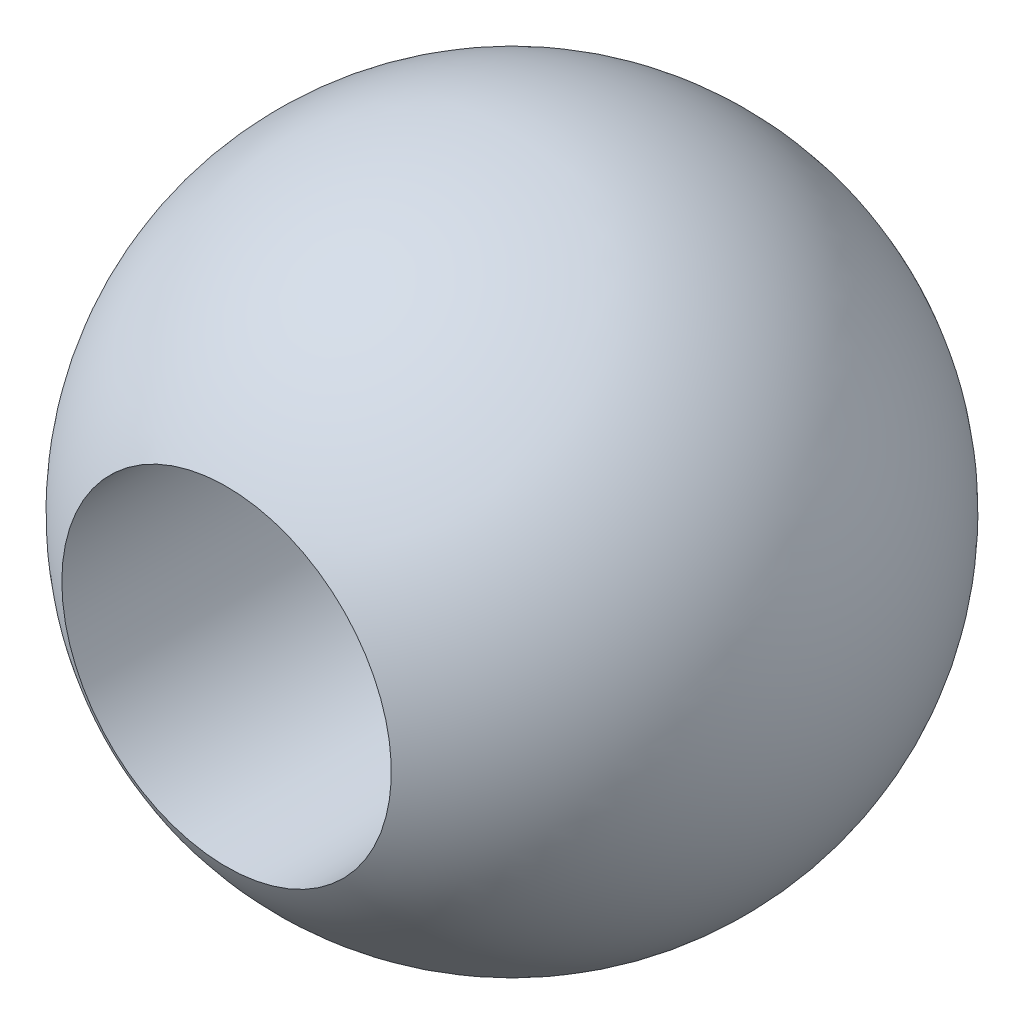
from build123d import *

# Parameters (mm, degrees)
CUT_EXTRUDE_1_DEPTH      = 7.92820323
CUT_EXTRUDE_1_DEPTH_BACK = 7.92820323
SKETCH_2_R               = 2


with BuildPart() as part:
    # 草图1 → 旋转1 (revolve)
    with BuildSketch(Plane.XY):
        with BuildLine():
            Line((0, 4), (0, -4))
            ThreePointArc((0, -4), (4, 0), (0, 4))
        make_face()
    revolve(axis=Axis((0, 4, 0), (0, -1, 0)))

    # 草图2 → 切除-拉伸1 (cut, two sides: drawn at the far end of the back side and taken through both)
    with BuildSketch(Plane.XY.offset(-CUT_EXTRUDE_1_DEPTH_BACK)):
        with Locations(Location((0, 0, 0), (0, 0, 180))):
            Circle(SKETCH_2_R)
    extrude(amount=CUT_EXTRUDE_1_DEPTH + CUT_EXTRUDE_1_DEPTH_BACK, mode=Mode.SUBTRACT)


solid = part.part
